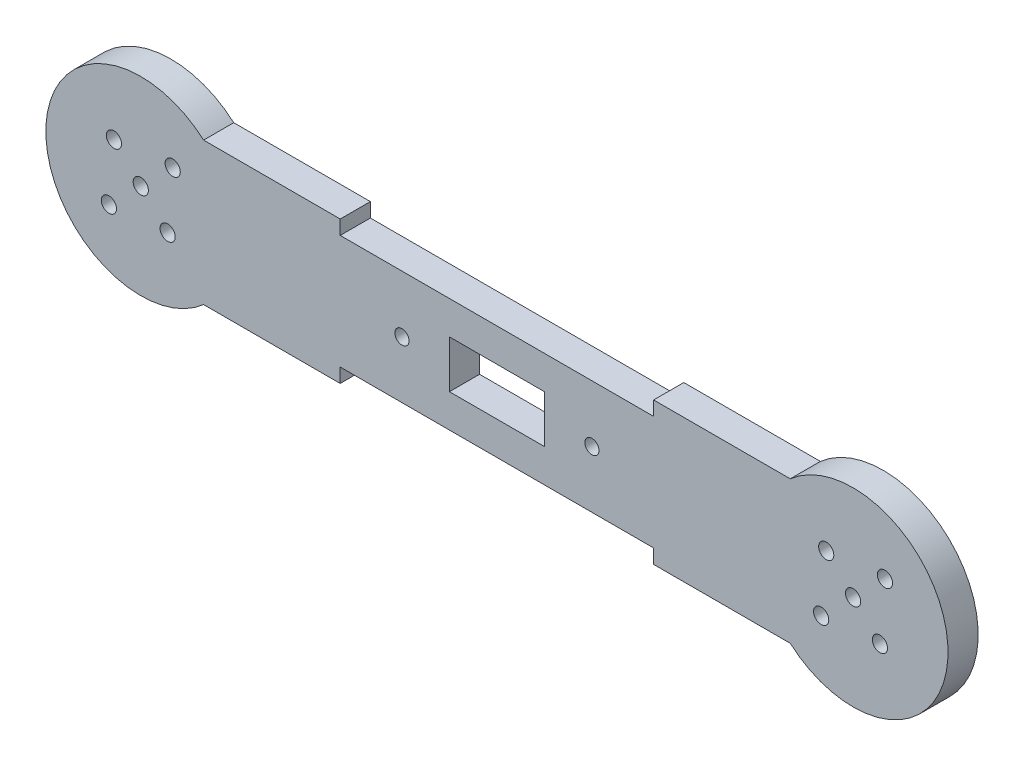
from build123d import *

# Parameters (mm, degrees)
SKETCH3_R                = 1.5
SKETCH3_W                = 20
SKETCH3_H                = 10
BOSS_EXTRUDE1_DEPTH      = 6.35
M3_CLEARANCE_HOLE1_D     = 3.2
M3_CLEARANCE_HOLE1_DEPTH = 7.5
M3_CLEARANCE_HOLE1_TIP   = 0.96137699
SKETCH4_W                = 66
SKETCH4_H                = 3
CUT_EXTRUDE1_DEPTH       = 10


with BuildPart() as part:
    # Sketch3 → Boss-Extrude1 (new body)
    with BuildSketch(Plane.XY):
        with BuildLine():
            Line((61.771243445, -15), (-61.771243445, -15))
            ThreePointArc((-61.771243445, -15), (-95, 0), (-61.771243445, 15))
            Line((-61.771243445, 15), (61.771243445, 15))
            ThreePointArc((61.771243445, 15), (95, 0), (61.771243445, -15))
        make_face()
        with Locations((-20, 0)):
            Circle(SKETCH3_R, mode=Mode.SUBTRACT)
        with Locations((20, 0)):
            Circle(SKETCH3_R, mode=Mode.SUBTRACT)
        Rectangle(SKETCH3_W, SKETCH3_H, mode=Mode.SUBTRACT)
    extrude(amount=BOSS_EXTRUDE1_DEPTH)

    # M3 Clearance Hole1
    with Locations(Plane(origin=(0, 0, 0), x_dir=(-1, 0, 0), z_dir=(0, 0, -1))):
        with Locations((81.717514421, -6.717514421), (75, 0), (0, 0), (-75, 0), (-69.343145751, 5.656854249), (-80.656854249, -5.656854249), (-81.717514421, 6.717514421), (-68.282485579, -6.717514421), (68.282485579, 6.717514421), (80.656854249, 5.656854249), (69.343145751, -5.656854249)):
            Hole(M3_CLEARANCE_HOLE1_D / 2, depth=M3_CLEARANCE_HOLE1_DEPTH)
            with Locations((0, 0, -(M3_CLEARANCE_HOLE1_DEPTH + M3_CLEARANCE_HOLE1_TIP / 2))):  # 118° drill point
                Cone(0, M3_CLEARANCE_HOLE1_D / 2, M3_CLEARANCE_HOLE1_TIP, mode=Mode.SUBTRACT)

    # Sketch4 → Cut-Extrude1 (cut)
    with BuildSketch(Plane(origin=(0, 0, 0), x_dir=(-1, 0, 0), z_dir=(0, 0, -1))):
        with Locations((0, 13.5)):
            Rectangle(SKETCH4_W, SKETCH4_H)
    cut_extrude1 = extrude(amount=-CUT_EXTRUDE1_DEPTH, mode=Mode.SUBTRACT)

    # Mirror1: Cut-Extrude1 across plane
    add(cut_extrude1.mirror(Plane.ZX), mode=Mode.SUBTRACT)


solid = part.part
